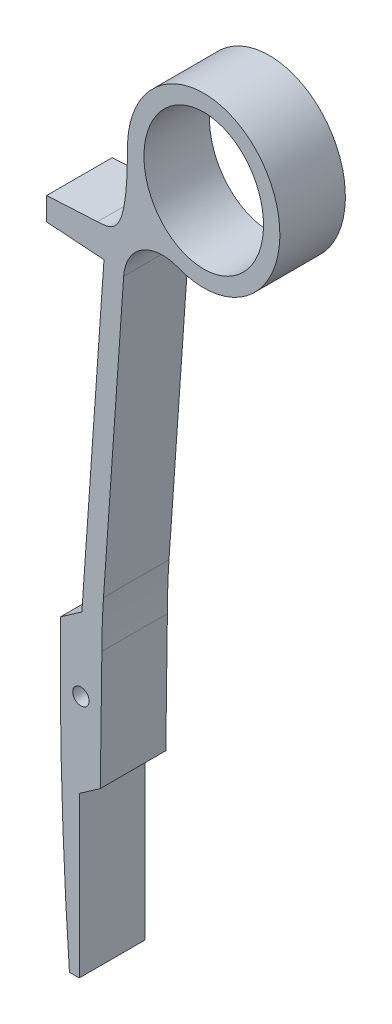
from build123d import *

# Parameters (mm, degrees)
SKETCH_4_RX     = 10.375
SKETCH_4_RY     = 9.125
EXTRUDE_1_DEPTH = 5
SKETCH_1_R      = 1.25
EXTRUDE_2_DEPTH = 5


with BuildPart() as part:
    # 草图4 → 凸台-拉伸1 (new, symmetric)
    with BuildSketch(Plane.XY):
        with BuildLine():
            Line((0.15, 11.25), (3.523968676, 59.5))
            Line((3.523968676, 59.5), (-5.226031324, 60.111859605))
            Line((-5.226031324, 60.111859605), (-5.226031324, 63.611859605))
            Line((-5.226031324, 63.611859605), (2.523968676, 64.018019894))
            add(Edge.make_bspline(
                [(7.125, 76.25), (7.125, 64.25), (5.186980769, 64.157582444), (2.523968676, 64.018019894)],
                knots=[0, 0, 0, 0, 1, 1, 1, 1], degree=3))
            add(Edge.make_bspline(
                [(14.885667795, 64.10597863), (49.352011719, 50.650461086), (28.238505859, 83.68922439), (7.125, 116.727987694), (7.125, 76.25)],
                knots=[5.944321556, 5.944321556, 5.944321556, 8.469947922, 8.469947922, 10.995574288, 10.995574288, 10.995574288], degree=2, weights=[1, 0.303137297, 1, 0.303137297, 1]))
            add(Edge.make_bspline(
                [(6.526125334, 58.8), (6.828403386, 63.122777551), (10.846177933, 65.674512797), (14.885667795, 64.10597863)],
                knots=[0, 0, 0, 0, 1, 1, 1, 1], degree=3))
            Line((6.526125334, 58.8), (3.449345608, 14.8))
            ThreePointArc((3.449345608, 14.8), (3.261001683, 11.177208299), (3.202238602, 7.55))
            Line((3.202238602, 7.55), (0.15, 11.25))
        make_face()
        with Locations(Location((18.75, 76.25), (0, 0, -90))):
            Ellipse(SKETCH_4_RX, SKETCH_4_RY, mode=Mode.SUBTRACT)
    extrude(amount=EXTRUDE_1_DEPTH, both=True)

    # 草图1 → 凸台-拉伸2 (add, symmetric)
    with BuildSketch(Plane.XY):
        with BuildLine():
            Line((-1.75, -37.35), (-0.25, -37.35))
            Line((-0.25, -37.35), (-0.25, -12.95))
            Line((-0.25, -12.95), (2.963333015, -10.7))
            Line((2.963333015, -10.7), (3.202238602, 7.55))
            Line((3.202238602, 7.55), (0.15, 11.25))
            Line((0.15, 11.25), (-3.126608177, 8.955694255))
            ThreePointArc((-3.126608177, 8.955694255), (-2.896852395, -14.210784919), (-1.75, -37.35))
        make_face()
        Circle(SKETCH_1_R, mode=Mode.SUBTRACT)
    extrude(amount=EXTRUDE_2_DEPTH, both=True)


solid = part.part
